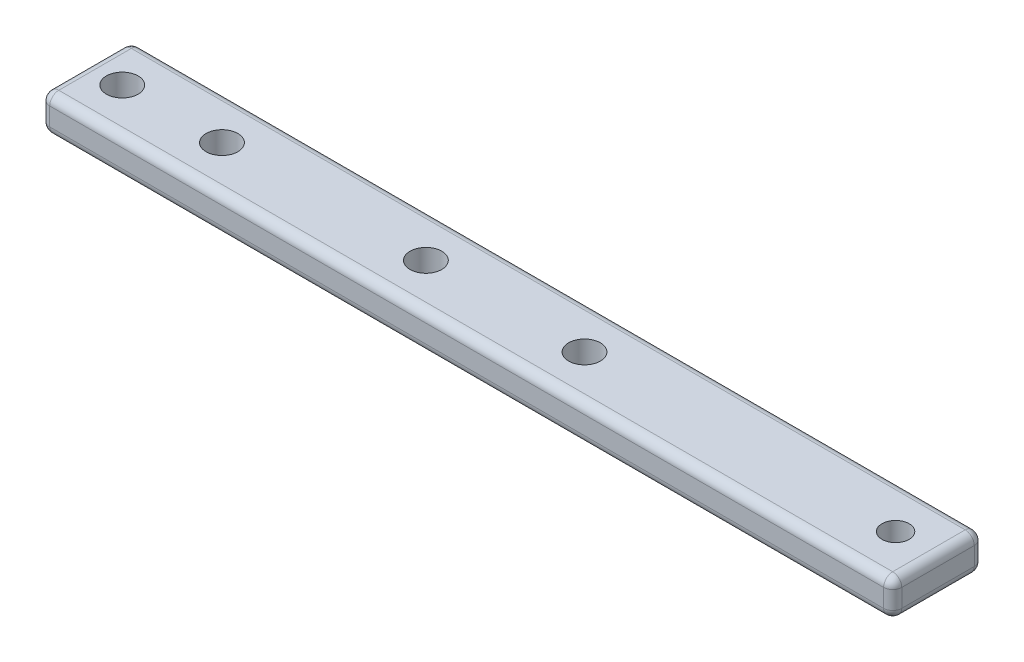
from build123d import *

# Parameters (mm, degrees)
SKETCH1_W               = 60
SKETCH1_H               = 10
BOSS_EXTRUDE1_DEPTH     = 4
SKETCH2_R               = 1.75
CUT_EXTRUDE1_DEPTH      = 4
SKETCH3_W               = 10
SKETCH3_H               = 4
BOSS_EXTRUDE2_DEPTH     = 40
SKETCH4_R               = 1.5
CUT_EXTRUDE2_DEPTH      = 10
CUT_EXTRUDE3_DEPTH      = 71.823724839
CUT_EXTRUDE3_DEPTH_BACK = 71.823724839
SKETCH5_W               = 6
SKETCH5_H               = 4
FILLET1_R               = 1


with BuildPart() as part:
    # Sketch1 → Boss-Extrude1 (new body)
    with BuildSketch(Plane(origin=(0, 0, 0), x_dir=(1, 0, 0), z_dir=(0, 1, 0))):
        Rectangle(SKETCH1_W, SKETCH1_H)
    extrude(amount=BOSS_EXTRUDE1_DEPTH)

    # Sketch2 → Cut-Extrude1 (cut)
    with BuildSketch(Plane(origin=(0, 4, 0), x_dir=(1, 0, 0), z_dir=(0, 1, 0))):
        with Locations(Location((-26, 0, 0), (0, 0, 270))):
            Circle(SKETCH2_R)
        with Locations(Location((7.5, 0, 0), (0, 0, 270))):
            Circle(SKETCH2_R)
        with Locations(Location((25, 0, 0), (0, 0, 270))):
            Circle(SKETCH2_R)
        with Locations(Location((-15, 0, 0), (0, 0, 270))):
            Circle(SKETCH2_R)
    extrude(amount=-CUT_EXTRUDE1_DEPTH, mode=Mode.SUBTRACT)

    # Sketch3 → Boss-Extrude2 (add)
    with BuildSketch(Plane(origin=(30, 0, 0), x_dir=(0, 0, -1), z_dir=(1, 0, 0))):
        with Locations((0, 2)):
            Rectangle(SKETCH3_W, SKETCH3_H)
    extrude(amount=BOSS_EXTRUDE2_DEPTH)

    # Sketch4 → Cut-Extrude2 (cut)
    with BuildSketch(Plane(origin=(0, 4, 0), x_dir=(1, 0, 0), z_dir=(0, 1, 0))):
        with Locations(Location((59.32, 0, 0), (0, 0, 270))):
            Circle(SKETCH4_R)
    extrude(amount=-CUT_EXTRUDE2_DEPTH, mode=Mode.SUBTRACT)

    # Sketch5 → Cut-Extrude3 (cut, two sides: drawn at the far end of the back side and taken through both)
    with BuildSketch(Plane.XY.offset(5).offset(-CUT_EXTRUDE3_DEPTH_BACK)):
        with Locations((67, 2)):
            Rectangle(SKETCH5_W, SKETCH5_H)
    extrude(amount=CUT_EXTRUDE3_DEPTH + CUT_EXTRUDE3_DEPTH_BACK, mode=Mode.SUBTRACT)

    # Fillet1
    fillet1_edges = [part.edges().sort_by_distance(p)[0] for p in [
        (-30, 4, 0),
        (17, 4, 5),
        (17, 0, 5),
        (17, 0, -5),
        (17, 4, -5),
        (-30, 0, 0),
        (64, 0, 0),
        (64, 2, 5),
        (64, 2, -5),
        (64, 4, 0),
        (-30, 2, 5),
        (-30, 2, -5),
    ]]
    fillet(fillet1_edges, radius=FILLET1_R)


solid = part.part
